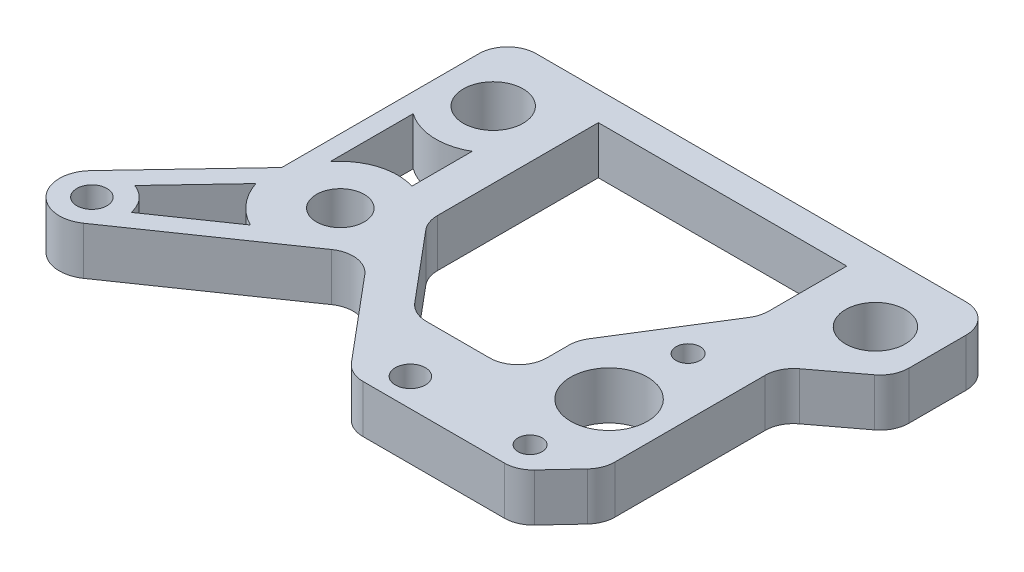
from build123d import *

# Parameters (mm, degrees)
SKETCH4_R           = 3.175
SKETCH4_R_2         = 3.96875
SKETCH4_R_3         = 5.1
SKETCH4_R_4         = 1.6
SKETCH4_R_5         = 2
BOSS_EXTRUDE2_DEPTH = 6.35


with BuildPart() as part:
    # Sketch4 → Boss-Extrude2 (new body)
    with BuildSketch(Plane(origin=(0, 0, 0), x_dir=(1, 0, 0), z_dir=(0, 1, 0))):
        with BuildLine():
            Line((40.257702493, -18.4375), (21.46596982, -18.4375))
            ThreePointArc((21.46596982, -18.4375), (19.855794242, -18.080532669), (18.547340491, -17.076520793))
            Line((18.547340491, -17.076520793), (9.268629328, -6.01858343))
            ThreePointArc((9.268629328, -6.01858343), (6.86044471, -4.691952465), (4.186444468, -5.331503545))
            Line((4.186444468, -5.331503545), (-15.327970397, -18.794247435))
            ThreePointArc((-15.327970397, -18.794247435), (-21.058470009, -18.050117151), (-20.917416467, -12.27322702))
            Line((-20.917416467, -12.27322702), (-8.5725, 0.781747009))
            Line((-8.5725, 0.781747009), (-8.5725, 26.9875))
            ThreePointArc((-8.5725, 26.9875), (-7.456576836, 29.681576836), (-4.7625, 30.7975))
            Line((-4.7625, 30.7975), (52.3875, 30.7975))
            ThreePointArc((52.3875, 30.7975), (55.081576836, 29.681576836), (56.1975, 26.9875))
            Line((56.1975, 26.9875), (56.1975, 19.362095927))
            ThreePointArc((56.1975, 19.362095927), (55.797199918, 17.662082259), (54.680415238, 16.319294633))
            Line((54.680415238, 16.319294633), (48.985566477, 12.027918285))
            ThreePointArc((48.985566477, 12.027918285), (47.868781798, 10.685130659), (47.468481715, 8.985116992))
            Line((47.468481715, 8.985116992), (47.468481715, -10.980610773))
            ThreePointArc((47.468481715, -10.980610773), (47.203372649, -12.376980446), (46.444939319, -13.579024524))
            Line((46.444939319, -13.579024524), (43.044160097, -17.225913752))
            ThreePointArc((43.044160097, -17.225913752), (41.776936446, -18.121498883), (40.257702493, -18.4375))
        make_face()
        with Locations(Location((0, 0, 0), (0, 0, 270))):
            Circle(SKETCH4_R, mode=Mode.SUBTRACT)
        with Locations(Location((-1.5875, 21.9075, 0), (0, 0, 270))):
            Circle(SKETCH4_R_2, mode=Mode.SUBTRACT)
        with Locations(Location((49.2125, 21.9075, 0), (0, 0, 270))):
            Circle(SKETCH4_R_2, mode=Mode.SUBTRACT)
        with Locations(Location((39.848481715, -4.1275, 0), (0, 0, 270))):
            Circle(SKETCH4_R_3, mode=Mode.SUBTRACT)
        with Locations(Location((39.848481715, -14.6275, 0), (0, 0, 270))):
            Circle(SKETCH4_R_4, mode=Mode.SUBTRACT)
        with Locations(Location((39.848481715, 6.3725, 0), (0, 0, 270))):
            Circle(SKETCH4_R_4, mode=Mode.SUBTRACT)
        with Locations(Location((24.012521227, -14.703599027, 0), (0, 0, 270))):
            Circle(SKETCH4_R_5, mode=Mode.SUBTRACT)
        with Locations(Location((-17.78, -15.24, 0), (0, 0, 270))):
            Circle(SKETCH4_R_5, mode=Mode.SUBTRACT)
        with BuildLine():
            Line((40.3225, 26.9875), (40.3225, 16.611657969))
            ThreePointArc((40.3225, 16.611657969), (40.174907062, 15.561479644), (39.743563246, 14.592665573))
            Line((39.743563246, 14.592665573), (31.537418469, 1.460088735))
            ThreePointArc((31.537418469, 1.460088735), (31.106074654, 0.491274664), (30.958481715, -0.558903662))
            Line((30.958481715, -0.558903662), (30.958481715, -3.507298313))
            ThreePointArc((30.958481715, -3.507298313), (29.842558552, -6.20137515), (27.148481715, -7.317298313))
            Line((27.148481715, -7.317298313), (18.766481715, -7.317298313))
            ThreePointArc((18.766481715, -7.317298313), (17.156306138, -6.960330982), (15.847852387, -5.956319106))
            Line((15.847852387, -5.956319106), (8.193870672, 3.165341101))
            ThreePointArc((8.193870672, 3.165341101), (7.532271115, 4.311265148), (7.3025, 5.614361894))
            Line((7.3025, 5.614361894), (7.3025, 26.9875))
            Line((7.3025, 26.9875), (40.3225, 26.9875))
        make_face(mode=Mode.SUBTRACT)
        with BuildLine():
            Line((-13.417009712, -14.390093684), (-4.038317295, -7.919854381))
            ThreePointArc((-4.038317295, -7.919854381), (-6.749791195, -5.78553531), (-8.444304622, -2.779535833))
            Line((-8.444304622, -2.779535833), (-16.272811714, -11.058324681))
            ThreePointArc((-16.272811714, -11.058324681), (-14.405104402, -12.347232345), (-13.417009712, -14.390093684))
        make_face(mode=Mode.SUBTRACT)
        with BuildLine():
            Line((2.2225, 7.28868258), (2.2225, 15.308386423))
            ThreePointArc((2.2225, 15.308386423), (-1.965402874, 14.296876542), (-6.0325, 15.718285591))
            Line((-6.0325, 15.718285591), (-6.0325, 4.65546386))
            ThreePointArc((-6.0325, 4.65546386), (-2.315704041, 7.259608446), (2.2225, 7.28868258))
        make_face(mode=Mode.SUBTRACT)
    extrude(amount=-BOSS_EXTRUDE2_DEPTH)


solid = part.part
